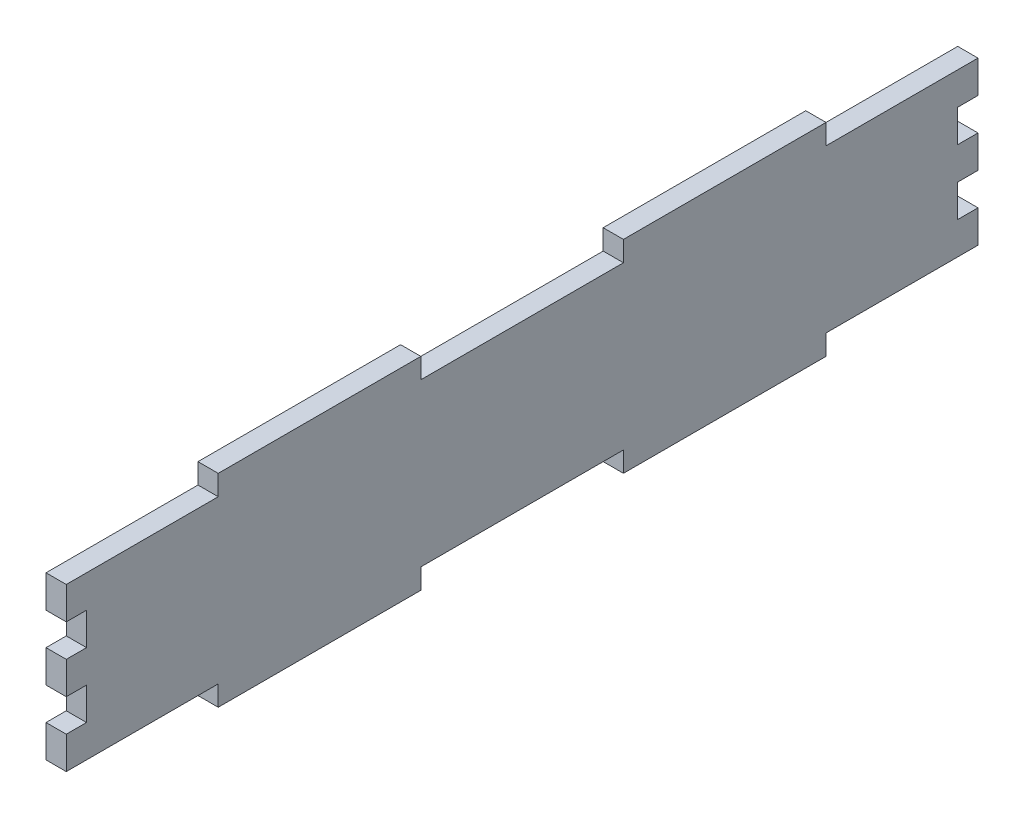
from build123d import *

# Parameters (mm, degrees)
BOSS_EXTRUDE1_DEPTH = 3


with BuildPart() as part:
    # Sketch1 → Boss-Extrude1 (new body)
    with BuildSketch(Plane(origin=(0, 0, 0), x_dir=(0, 0, -1), z_dir=(1, 0, 0))):
        Polygon((6.450441839, 2.822342732), (25.950441839, 2.822342732), (25.950441839, -0.177657268), (55.950441839, -0.177657268), (55.950441839, 2.822342732), (85.950441839, 2.822342732), (85.950441839, -0.177657268), (115.950441839, -0.177657268), (115.950441839, 2.822342732), (135.450441839, 2.822342732), (138.450441839, 2.822342732), (138.450441839, 7.622342732), (135.450441839, 7.622342732), (135.450441839, 12.422342732), (138.450441839, 12.422342732), (138.450441839, 17.222342732), (135.450441839, 17.222342732), (135.450441839, 22.022342732), (138.450441839, 22.022342732), (138.450441839, 26.822342732), (135.450441839, 26.822342732), (115.950441839, 26.822342732), (115.950441839, 29.822342732), (85.950441839, 29.822342732), (85.950441839, 26.822342732), (55.950441839, 26.822342732), (55.950441839, 29.822342732), (25.950441839, 29.822342732), (25.950441839, 26.822342732), (6.450441839, 26.822342732), (3.450441839, 26.822342732), (3.450441839, 22.022342732), (6.450441839, 22.022342732), (6.450441839, 17.222342732), (3.450441839, 17.222342732), (3.450441839, 12.422342732), (6.450441839, 12.422342732), (6.450441839, 7.622342732), (3.450441839, 7.622342732), (3.450441839, 2.822342732), align=None)
    extrude(amount=BOSS_EXTRUDE1_DEPTH)


solid = part.part
